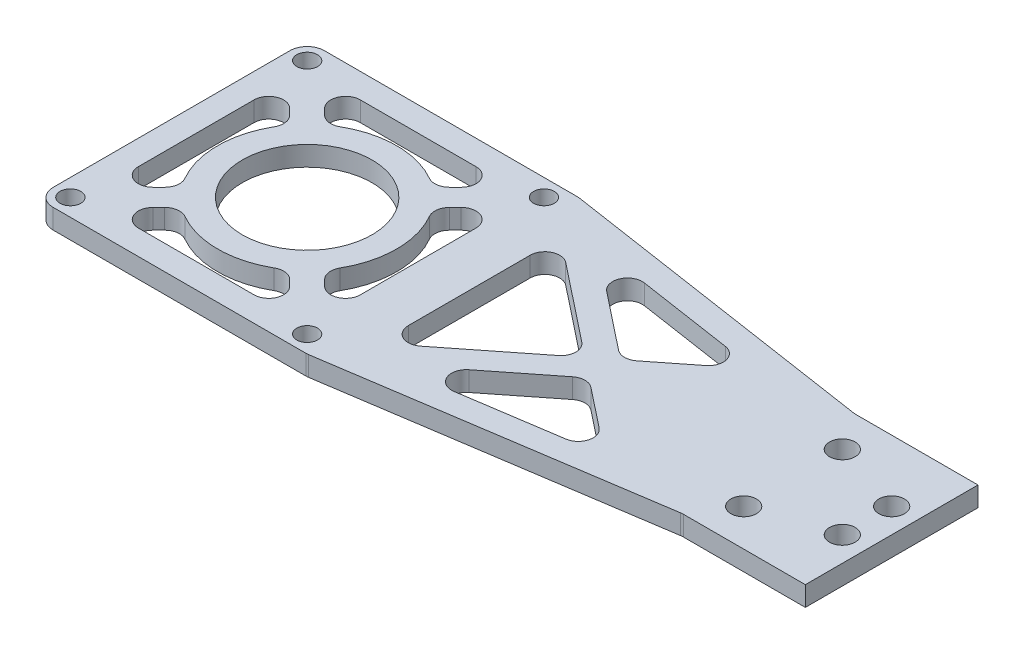
from build123d import *

# Parameters (mm, degrees)
SKETCH_1_W                       = 25
SKETCH_1_H                       = 35
SKETCH_1_R                       = 2.6
EXTRUDE_1_DEPTH                  = 4
EXTRUDE_2_DEPTH                  = 4
FILLET_1_R                       = 3.5
CUT_EXTRUDE_1_DEPTH              = 10
SKETCH_4_R                       = 2.1
CUT_EXTRUDE_2_DEPTH              = 10
PATTERN_CIRCULAR_1_COUNT         = 4
CUT_EXTRUDE_3_DEPTH              = 10
FILLET_2_R                       = 3
PATTERN_CIRCULAR_2_COUNT         = 4
FILLET_2_OF_PATTERN_CIRCULAR_2_R = 3
CUT_EXTRUDE_4_DEPTH              = 10
FILLET_3_R                       = 3


with BuildPart() as part:
    # 草图1 → 凸台-拉伸1 (new body)
    with BuildSketch(Plane(origin=(0, 0, 0), x_dir=(1, 0, 0), z_dir=(0, 1, 0))):
        Rectangle(SKETCH_1_W, SKETCH_1_H)
        with Locations(Location((7.5, 5, 0), (0, 0, 270))):
            Circle(SKETCH_1_R, mode=Mode.SUBTRACT)
        with Locations(Location((7.5, -5, 0), (0, 0, 270))):
            Circle(SKETCH_1_R, mode=Mode.SUBTRACT)
        with Locations(Location((-7.5, -10, 0), (0, 0, 270))):
            Circle(SKETCH_1_R, mode=Mode.SUBTRACT)
        with Locations(Location((-7.5, 10, 0), (0, 0, 270))):
            Circle(SKETCH_1_R, mode=Mode.SUBTRACT)
    extrude(amount=EXTRUDE_1_DEPTH)


with BuildPart() as body_2:
    # 草图2 → 凸台-拉伸2 (new body)
    with BuildSketch(Plane(origin=(0, 4, 0), x_dir=(1, 0, 0), z_dir=(0, 1, 0))):
        Polygon((-133.482, 27.5), (-78.482, 27.5), (-12.5, 17.5), (-12.5, -17.5), (-78.482, -27.5), (-133.482, -27.5), align=None)
    extrude(amount=-EXTRUDE_2_DEPTH)


with BuildPart() as part_1:
    add(part.part)

    # Combine 1: union body 2
    add(body_2.part)

    # 圆角1
    fillet_1_edges = [part_1.edges().sort_by_distance(p)[0] for p in [
        (-12.5, 2, -17.5),
        (-12.5, 2, 17.5),
        (-78.482, 2, 27.5),
        (-133.482, 2, 27.5),
        (-133.482, 2, -27.5),
        (-78.482, 2, -27.5),
    ]]
    fillet(fillet_1_edges, radius=FILLET_1_R)

    # 草图3 → 切除-拉伸1 (cut)
    with BuildSketch(Plane(origin=(0, 4, 0), x_dir=(1, 0, 0), z_dir=(0, 1, 0))):
        with BuildLine():
            ThreePointArc((-92.832, 0), (-100.949712864, 12.149015853), (-115.280454173, 9.298454173))
            Line((-115.280454173, 9.298454173), (-105.982, 0))
            Line((-105.982, 0), (-115.280454173, -9.298454173))
            ThreePointArc((-115.280454173, -9.298454173), (-100.949712864, -12.149015853), (-92.832, 0))
        make_face()
        with BuildLine():
            Line((-105.982, 0), (-115.280454173, 9.298454173))
            ThreePointArc((-115.280454173, 9.298454173), (-119.132, 0), (-115.280454173, -9.298454173))
            Line((-115.280454173, -9.298454173), (-105.982, 0))
        make_face()
        with BuildLine():
            ThreePointArc((-92.832, 0), (-100.949712864, 12.149015853), (-115.280454173, 9.298454173))
            Line((-115.280454173, 9.298454173), (-105.982, 0))
            Line((-105.982, 0), (-115.280454173, -9.298454173))
            ThreePointArc((-115.280454173, -9.298454173), (-100.949712864, -12.149015853), (-92.832, 0))
        make_face()
        with BuildLine():
            Line((-105.982, 0), (-115.280454173, 9.298454173))
            ThreePointArc((-115.280454173, 9.298454173), (-119.132, 0), (-115.280454173, -9.298454173))
            Line((-115.280454173, -9.298454173), (-105.982, 0))
        make_face()
    extrude(amount=-CUT_EXTRUDE_1_DEPTH, mode=Mode.SUBTRACT)

    # 草图4 → 切除-拉伸2 (cut)
    with BuildSketch(Plane(origin=(0, 4, 0), x_dir=(1, 0, 0), z_dir=(0, 1, 0))):
        with Locations(Location((-81.982, 24, 0), (0, 0, 270))):
            Circle(SKETCH_4_R)
    cut_extrude_2 = extrude(amount=-CUT_EXTRUDE_2_DEPTH, mode=Mode.SUBTRACT)

    # 阵列(圆周)1: 切除-拉伸2 ×4 about axis
    pattern_circular_1_axis = Axis((-105.982, 0, 0), (0, 1, 0))
    for i in range(1, PATTERN_CIRCULAR_1_COUNT):
        add(cut_extrude_2.rotate(pattern_circular_1_axis, i * 360 / PATTERN_CIRCULAR_1_COUNT), mode=Mode.SUBTRACT)

    # 草图5 → 切除-拉伸3 (cut)
    with BuildSketch(Plane(origin=(0, 4, 0), x_dir=(1, 0, 0), z_dir=(0, 1, 0))):
        with BuildLine():
            Line((-120.461424988, 10.943891082), (-128.482, 18.964466094))
            Line((-128.482, 18.964466094), (-128.482, -18.964466094))
            Line((-128.482, -18.964466094), (-120.461424988, -10.943891082))
            ThreePointArc((-120.461424988, -10.943891082), (-124.132, 0), (-120.461424988, 10.943891082))
        make_face()
    cut_extrude_3 = extrude(amount=-CUT_EXTRUDE_3_DEPTH, mode=Mode.SUBTRACT)

    # 圆角2
    fillet_2_edges = [part_1.edges().sort_by_distance(p)[0] for p in [
        (-120.461424988, 2, -10.943891082),
        (-120.461424988, 2, 10.943891082),
        (-128.482, 2, 18.964466094),
        (-128.482, 2, -18.964466094),
    ]]
    fillet(fillet_2_edges, radius=FILLET_2_R)

    # 阵列(圆周)2: 切除-拉伸3 ×4 about axis
    pattern_circular_2_axis = Axis((-105.982, 0, 0), (0, 1, 0))
    for i in range(1, PATTERN_CIRCULAR_2_COUNT):
        add(cut_extrude_3.rotate(pattern_circular_2_axis, i * 360 / PATTERN_CIRCULAR_2_COUNT), mode=Mode.SUBTRACT)

    # 圆角2 of 阵列(圆周)2
    fillet_2_of_pattern_circular_2_edges = [part_1.edges().sort_by_distance(p)[0] for p in [
        (-116.925891082, 2, 14.479424988),
        (-95.038108918, 2, 14.479424988),
        (-87.017533906, 2, 22.5),
        (-124.946466094, 2, 22.5),
        (-91.502575012, 2, 10.943891082),
        (-91.502575012, 2, -10.943891082),
        (-83.482, 2, -18.964466094),
        (-83.482, 2, 18.964466094),
        (-95.038108918, 2, -14.479424988),
        (-116.925891082, 2, -14.479424988),
        (-124.946466094, 2, -22.5),
        (-87.017533906, 2, -22.5),
    ]]
    fillet(fillet_2_of_pattern_circular_2_edges, radius=FILLET_2_OF_PATTERN_CIRCULAR_2_R)

    # 草图6 → 切除-拉伸4 (cut)
    with BuildSketch(Plane(origin=(0, 4, 0), x_dir=(1, 0, 0), z_dir=(0, 1, 0))):
        Polygon((-73.221259435, -18.460580976), (-49.753485721, 0.064081858), (-73.221259435, 18.634602448), align=None)
        Polygon((-45.719729218, 3.248192123), (-30.596936447, 15.18561067), (-67.961344653, 20.848429046), align=None)
        Polygon((-68.227570637, -20.88877732), (-30.500709207, -15.171026808), (-45.723561893, -3.124877792), align=None)
    extrude(amount=-CUT_EXTRUDE_4_DEPTH, mode=Mode.SUBTRACT)

    # 圆角3
    fillet_3_edges = [part_1.edges().sort_by_distance(p)[0] for p in [
        (-30.500709207, 2, 15.171026808),
        (-68.227570637, 2, 20.88877732),
        (-45.723561893, 2, 3.124877792),
        (-45.719729218, 2, -3.248192123),
        (-67.961344653, 2, -20.848429046),
        (-30.596936447, 2, -15.18561067),
        (-73.221259435, 2, 18.460580976),
        (-73.221259435, 2, -18.634602448),
        (-49.753485721, 2, -0.064081858),
    ]]
    fillet(fillet_3_edges, radius=FILLET_3_R)


solid = part_1.part
